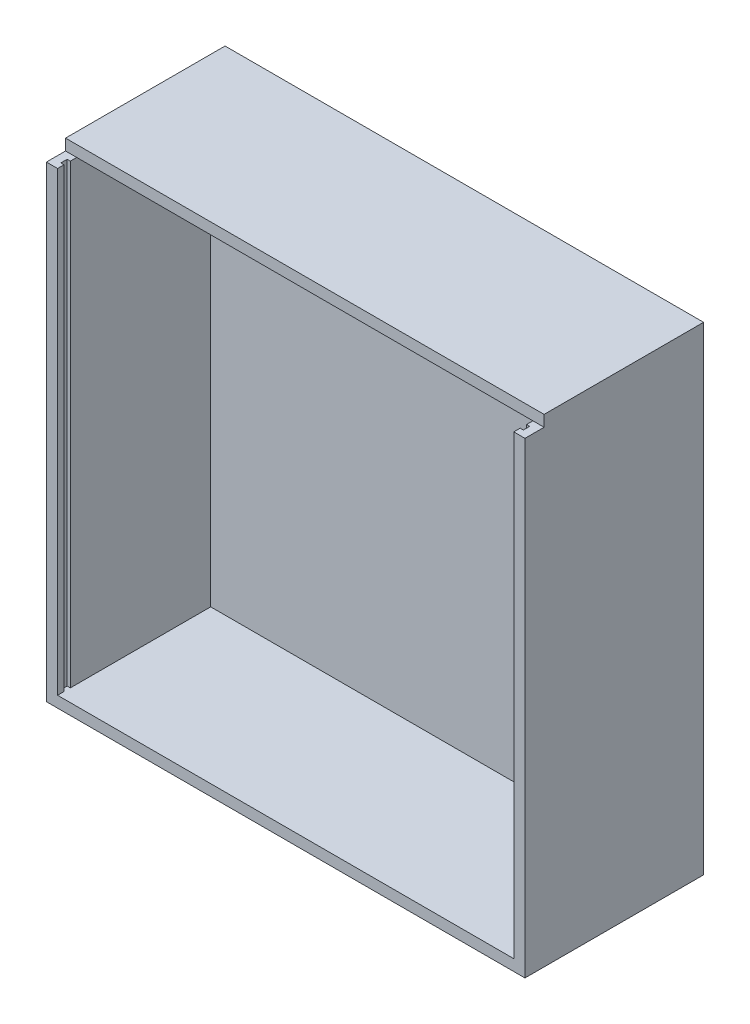
from build123d import *

# Parameters (mm, degrees)
SKETCH1_W           = 150
SKETCH1_H           = 150
BOSS_EXTRUDE1_DEPTH = 8
SKETCH4_W           = 150
SKETCH4_H           = 150
SKETCH4_W_2         = 143
SKETCH4_H_2         = 143
BOSS_EXTRUDE2_DEPTH = 42
EXTRUDE_THIN1_DEPTH = 6
SKETCH6_W           = 2
SKETCH6_H           = 2
CUT_EXTRUDE1_DEPTH  = 143


with BuildPart() as part:
    # Sketch1 → Boss-Extrude1 (new body)
    with BuildSketch(Plane.XY):
        Rectangle(SKETCH1_W, SKETCH1_H)
    extrude(amount=BOSS_EXTRUDE1_DEPTH)

    # Sketch4 → Boss-Extrude2 (add)
    with BuildSketch(Plane.XY.offset(8)):
        Rectangle(SKETCH4_W, SKETCH4_H)
        Rectangle(SKETCH4_W_2, SKETCH4_H_2, mode=Mode.SUBTRACT)
    extrude(amount=BOSS_EXTRUDE2_DEPTH)

    # Sketch5 → Extrude-Thin1 (add)
    with BuildSketch(Plane.XY.offset(50)):
        Polygon((71.5, 71.5), (71.5, -71.5), (-71.5, -71.5), (-71.5, 71.5), (-75, 71.5), (-75, -75), (75, -75), (75, 71.5), align=None)
    extrude(amount=EXTRUDE_THIN1_DEPTH)

    # Sketch6 → Cut-Extrude1 (cut)
    with BuildSketch(Plane(origin=(0, 71.5, 0), x_dir=(1, 0, 0), z_dir=(0, 1, 0))):
        with Locations((71.5, -53)):
            Rectangle(SKETCH6_W, SKETCH6_H)
    cut_extrude1 = extrude(amount=-CUT_EXTRUDE1_DEPTH, mode=Mode.SUBTRACT)

    # Mirror1: Cut-Extrude1 across plane
    add(cut_extrude1.mirror(Plane(origin=(0, 0, 0), x_dir=(0, 0, 1), z_dir=(1, 0, 0))), mode=Mode.SUBTRACT)


solid = part.part
